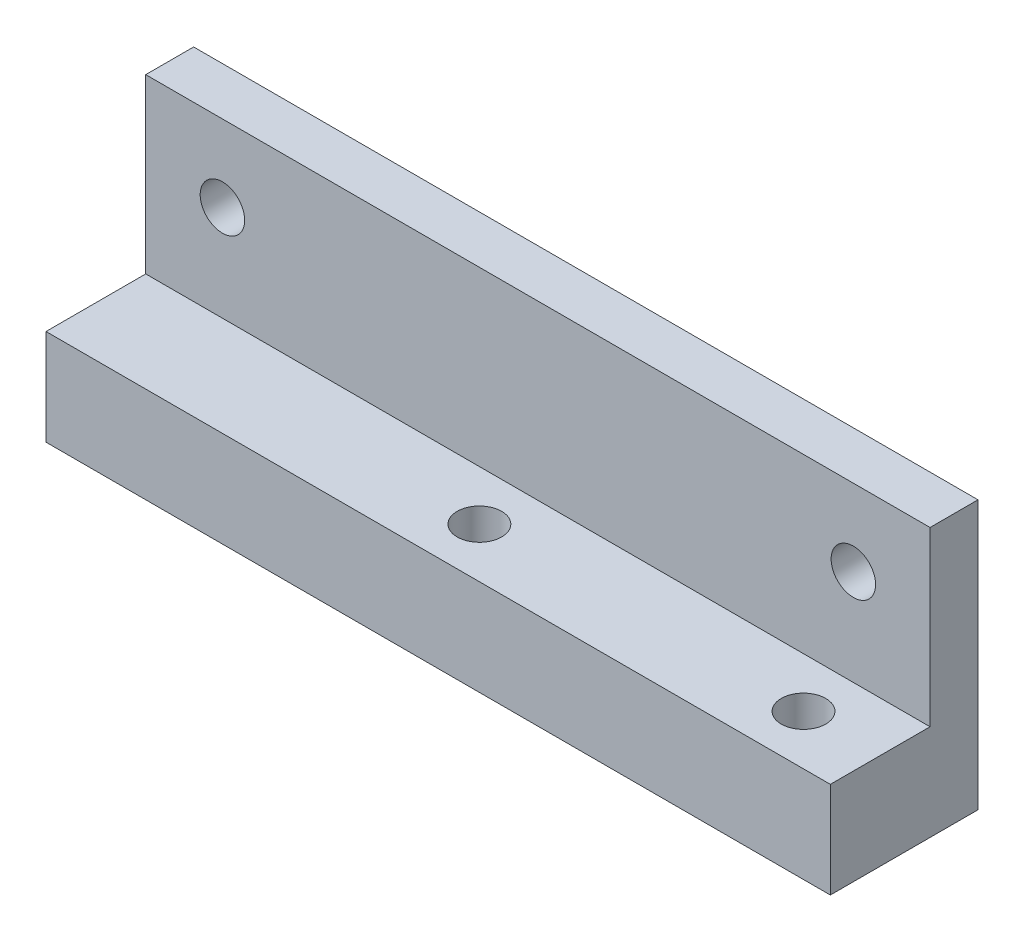
from build123d import *

# Parameters (mm, degrees)
SKETCH1_W           = 51.943
SKETCH1_H           = 9.779
BOSS_EXTRUDE1_DEPTH = 6.35
SKETCH2_W           = 51.943
SKETCH2_H           = 3.175
BOSS_EXTRUDE2_DEPTH = 11.43
SKETCH4_R           = 1.4732
CUT_EXTRUDE1_DEPTH  = 6.35
SKETCH3_R           = 1.4732
CUT_EXTRUDE2_DEPTH  = 6.35


with BuildPart() as part:
    # Sketch1 → Boss-Extrude1 (new body)
    with BuildSketch(Plane(origin=(0, 0, 0), x_dir=(1, 0, 0), z_dir=(0, 1, 0))):
        with Locations((25.9715, 4.8895)):
            Rectangle(SKETCH1_W, SKETCH1_H)
    extrude(amount=BOSS_EXTRUDE1_DEPTH)

    # Sketch2 → Boss-Extrude2 (add)
    with BuildSketch(Plane(origin=(0, 6.35, 0), x_dir=(1, 0, 0), z_dir=(0, 1, 0))):
        with Locations((25.9715, 8.1915)):
            Rectangle(SKETCH2_W, SKETCH2_H)
    extrude(amount=BOSS_EXTRUDE2_DEPTH)

    # Sketch4 → Cut-Extrude1 (cut)
    with BuildSketch(Plane.XY.offset(-6.604)):
        with Locations((46.863, 12.7)):
            Circle(SKETCH4_R)
        with Locations((5.08, 12.7)):
            Circle(SKETCH4_R)
    extrude(amount=-CUT_EXTRUDE1_DEPTH, mode=Mode.SUBTRACT)

    # Sketch3 → Cut-Extrude2 (cut)
    with BuildSketch(Plane(origin=(0, 6.35, 0), x_dir=(1, 0, 0), z_dir=(0, 1, 0))):
        with Locations(Location((25.4, 3.302, 0), (0, 0, 270))):
            Circle(SKETCH3_R)
        with Locations(Location((46.863, 3.302, 0), (0, 0, 270))):
            Circle(SKETCH3_R)
    extrude(amount=-CUT_EXTRUDE2_DEPTH, mode=Mode.SUBTRACT)


solid = part.part
